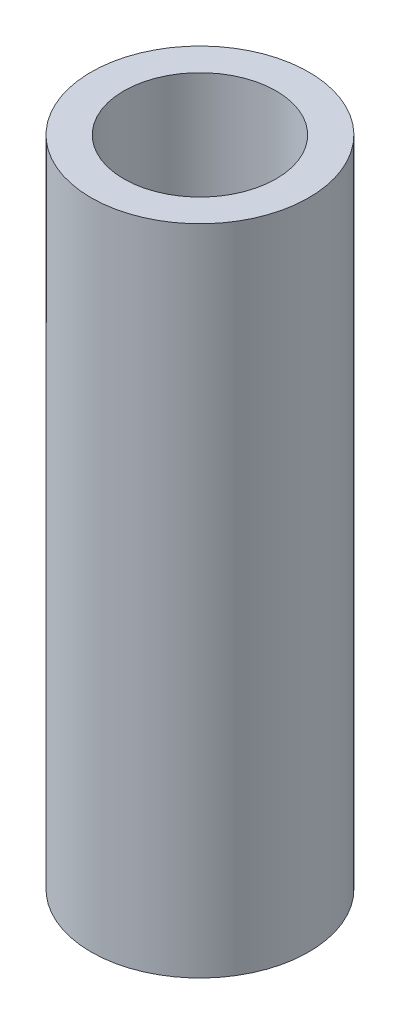
from build123d import *

# Parameters (mm, degrees)
SKETCH1_R           = 5
BOSS_EXTRUDE1_DEPTH = 30
CUT_EXTRUDE1_REACH  = 32.822
SKETCH2_R           = 2
SKETCH3_R           = 3.5
CUT_EXTRUDE2_DEPTH  = 25


with BuildPart() as part:
    # Sketch1 → Boss-Extrude1 (new body)
    with BuildSketch(Plane(origin=(0, 0, 0), x_dir=(1, 0, 0), z_dir=(0, 1, 0))):
        with Locations(Location((0, 0, 0), (0, 0, 270))):
            Circle(SKETCH1_R)
    extrude(amount=BOSS_EXTRUDE1_DEPTH)

    # Sketch2 → Cut-Extrude1 (cut, up to next)
    with BuildSketch(Plane(origin=(0, 30, 0), x_dir=(1, 0, 0), z_dir=(0, 1, 0)), mode=Mode.PRIVATE) as cut_extrude1_sk1:
        with Locations(Location((0, 0, 0), (0, 0, 270))):
            Circle(SKETCH2_R)
    cut_extrude1_tool1 = extrude(cut_extrude1_sk1.sketch, amount=-CUT_EXTRUDE1_REACH, mode=Mode.PRIVATE) & part.part
    add(cut_extrude1_tool1.solids().sort_by_distance((0, 30, 0))[0], mode=Mode.SUBTRACT)

    # Sketch3 → Cut-Extrude2 (cut)
    with BuildSketch(Plane(origin=(0, 30, 0), x_dir=(1, 0, 0), z_dir=(0, 1, 0))):
        with Locations(Location((0, 0, 0), (0, 0, 270))):
            Circle(SKETCH3_R)
    extrude(amount=-CUT_EXTRUDE2_DEPTH, mode=Mode.SUBTRACT)


solid = part.part
